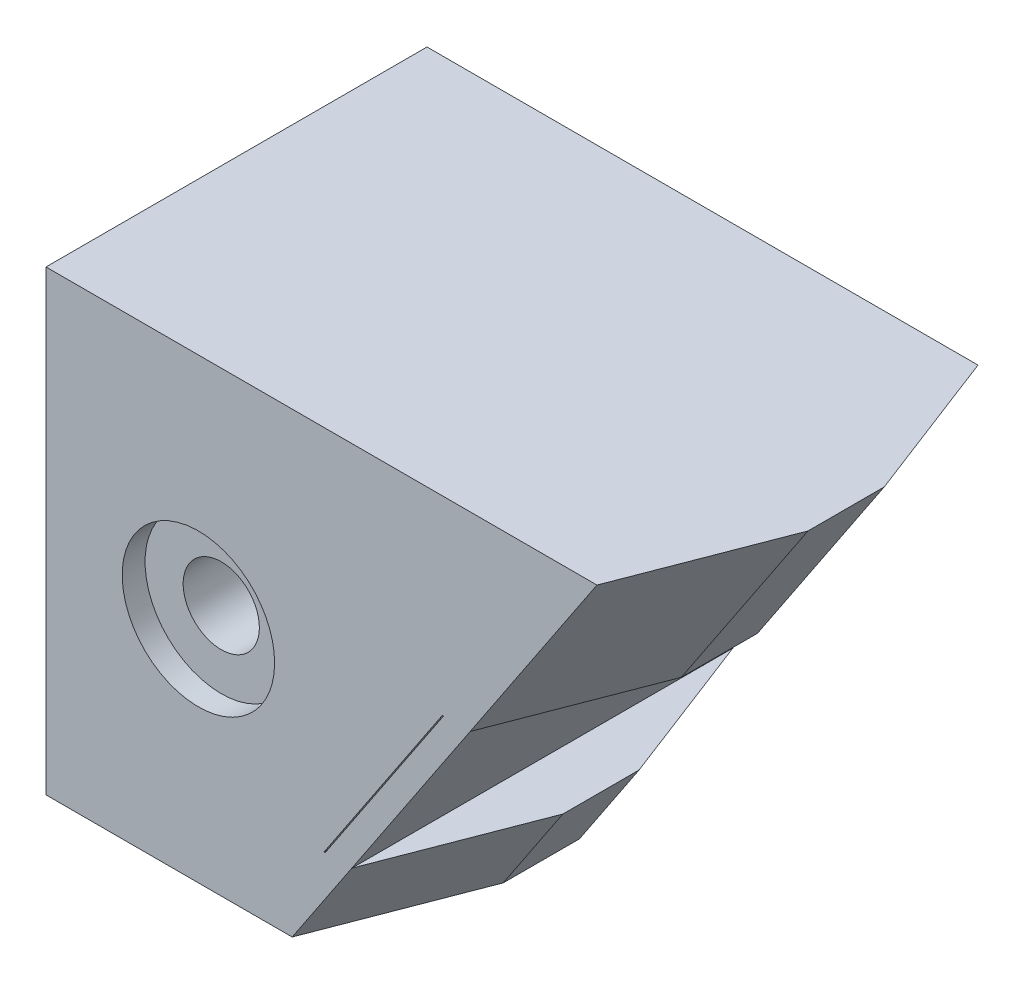
from build123d import *

# Parameters (mm, degrees)
BOSS_EXTRUDE4_DEPTH                                 = 50
CBORE_FOR_00_BINDING_HEAD_MACHINE_SCREW_D           = 10.000000066
CBORE_FOR_00_BINDING_HEAD_MACHINE_SCREW_CBORE_D     = 19.999999878
CBORE_FOR_00_BINDING_HEAD_MACHINE_SCREW_CBORE_DEPTH = 3.000000096
BOSS_EXTRUDE5_REACH                                 = 119.883
SKETCH13_W                                          = 50
SKETCH13_H                                          = 2.915477917
BOSS_EXTRUDE5_DIRECTION_2_REACH                     = 119.883
CUT_EXTRUDE4_REACH                                  = 119.883
CUT_EXTRUDE4_DIRECTION_2_REACH                      = 119.883


with BuildPart() as part:
    # Sketch1 → Boss-Extrude4 (new body)
    with BuildSketch(Plane.XY):
        Polygon((-77.115898542, 75.206245128), (-77.115898542, 15.206245128), (-37.115898542, 15.206245128), (-29.288509924, 26.947328056), (-40.64113729, 26.947328056), (-25.109531796, 50.244736298), (-13.756904429, 50.244736298), (2.884101458, 75.206245128), align=None)
    extrude(amount=-BOSS_EXTRUDE4_DEPTH)

    # CBORE for #00 Binding Head Machine Screw2 (through all)
    with Locations(Plane.XY):
        with Locations((-57.115898542, 45.206245128)):
            CounterBoreHole(CBORE_FOR_00_BINDING_HEAD_MACHINE_SCREW_D / 2, CBORE_FOR_00_BINDING_HEAD_MACHINE_SCREW_CBORE_D / 2, CBORE_FOR_00_BINDING_HEAD_MACHINE_SCREW_CBORE_DEPTH)

    # Sketch13 → Boss-Extrude5 (add, up to next)
    with BuildSketch(Plane(origin=(3.425379126, 5.13806869, 0), x_dir=(0, 0, 1), z_dir=(0.5547001962252258, 0.8320502943378458, 0)), mode=Mode.PRIVATE) as boss_extrude5_sk1:
        with Locations((-25, -47.17806466)):
            Rectangle(SKETCH13_W, SKETCH13_H)
    boss_extrude5_tool1 = extrude(boss_extrude5_sk1.sketch, amount=BOSS_EXTRUDE5_REACH, mode=Mode.PRIVATE) - part.part
    add(boss_extrude5_tool1.solids().sort_by_distance((-35.829143, 31.30775, -25))[0])

    # Sketch13 → Boss-Extrude5 direction 2 (add, up to next)
    with BuildSketch(Plane(origin=(3.425379126, 5.13806869, 0), x_dir=(0, 0, 1), z_dir=(0.5547001962252258, 0.8320502943378458, 0)), mode=Mode.PRIVATE) as boss_extrude5_direction_2_sk1:
        with Locations((-25, -47.17806466)):
            Rectangle(SKETCH13_W, SKETCH13_H)
    boss_extrude5_direction_2_tool1 = extrude(boss_extrude5_direction_2_sk1.sketch, amount=-BOSS_EXTRUDE5_DIRECTION_2_REACH, mode=Mode.PRIVATE) - part.part
    add(boss_extrude5_direction_2_tool1.solids().sort_by_distance((-35.829143, 31.30775, -25))[0])

    # Sketch13<5> → Cut-Extrude4 (cut, up to next)
    with BuildSketch(Plane(origin=(3.425379126, 5.13806869, 0), x_dir=(0, 0, 1), z_dir=(0.5547001962252258, 0.8320502943378458, 0)), mode=Mode.PRIVATE) as cut_extrude4_sk1:
        Polygon((0, -39.317201463), (-20, -39.317201463), (0, -45.720325701), align=None)
    cut_extrude4_tool1 = extrude(cut_extrude4_sk1.sketch, amount=-CUT_EXTRUDE4_REACH, mode=Mode.PRIVATE) & part.part
    # Sketch13<5> → Cut-Extrude4 (cut, up to next)
    with BuildSketch(Plane(origin=(3.425379126, 5.13806869, 0), x_dir=(0, 0, 1), z_dir=(0.5547001962252258, 0.8320502943378458, 0)), mode=Mode.PRIVATE) as cut_extrude4_sk2:
        Polygon((-50, -45.720325701), (-30, -39.317201463), (-50, -39.317201463), align=None)
    cut_extrude4_tool2 = extrude(cut_extrude4_sk2.sketch, amount=-CUT_EXTRUDE4_REACH, mode=Mode.PRIVATE) & part.part
    add(cut_extrude4_tool1.solids().sort_by_distance((-31.064417, 28.131266, -6.666667))[0], mode=Mode.SUBTRACT)
    add(cut_extrude4_tool2.solids().sort_by_distance((-31.064417, 28.131266, -43.333333))[0], mode=Mode.SUBTRACT)

    # Sketch13<5> → Cut-Extrude4 direction 2 (cut, up to next)
    with BuildSketch(Plane(origin=(3.425379126, 5.13806869, 0), x_dir=(0, 0, 1), z_dir=(0.5547001962252258, 0.8320502943378458, 0)), mode=Mode.PRIVATE) as cut_extrude4_direction_2_sk1:
        Polygon((0, -39.317201463), (-20, -39.317201463), (0, -45.720325701), align=None)
    cut_extrude4_direction_2_tool1 = extrude(cut_extrude4_direction_2_sk1.sketch, amount=CUT_EXTRUDE4_DIRECTION_2_REACH, mode=Mode.PRIVATE) & part.part
    # Sketch13<5> → Cut-Extrude4 direction 2 (cut, up to next)
    with BuildSketch(Plane(origin=(3.425379126, 5.13806869, 0), x_dir=(0, 0, 1), z_dir=(0.5547001962252258, 0.8320502943378458, 0)), mode=Mode.PRIVATE) as cut_extrude4_direction_2_sk2:
        Polygon((-50, -45.720325701), (-30, -39.317201463), (-50, -39.317201463), align=None)
    cut_extrude4_direction_2_tool2 = extrude(cut_extrude4_direction_2_sk2.sketch, amount=CUT_EXTRUDE4_DIRECTION_2_REACH, mode=Mode.PRIVATE) & part.part
    add(cut_extrude4_direction_2_tool1.solids().sort_by_distance((-31.064417, 28.131266, -6.666667))[0], mode=Mode.SUBTRACT)
    add(cut_extrude4_direction_2_tool2.solids().sort_by_distance((-31.064417, 28.131266, -43.333333))[0], mode=Mode.SUBTRACT)


solid = part.part
